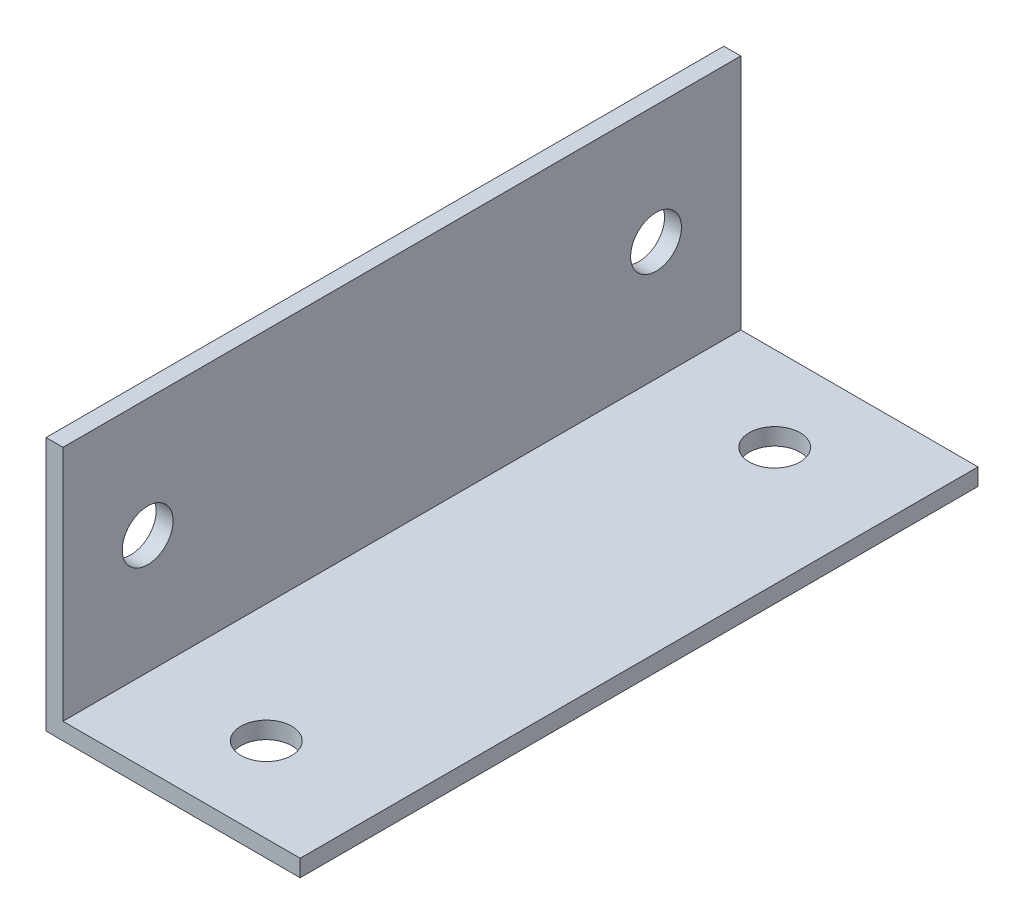
from build123d import *

# Parameters (mm, degrees)
EXTRUDE_1_DEPTH     = 40
SKETCH_2_R          = 1.5
CUT_EXTRUDE_1_DEPTH = 45.631827209


with BuildPart() as part:
    # 草图1 → 凸台-拉伸1 (new body)
    with BuildSketch(Plane.XY):
        Polygon((0, 0), (0, 14), (-1, 14), (-1, -1), (14, -1), (14, 0), align=None)
    extrude(amount=EXTRUDE_1_DEPTH)

    # 草图2 → 切除-拉伸1 (cut, through all)
    with BuildSketch(Plane(origin=(0, 0, 0), x_dir=(1, 0, 0), z_dir=(0, 1, 0))):
        with Locations(Location((7, -5, 0), (0, 0, 180))):
            Circle(SKETCH_2_R)
        with Locations((7, -35)):
            Circle(SKETCH_2_R)
    cut_extrude_1 = extrude(amount=-CUT_EXTRUDE_1_DEPTH, mode=Mode.SUBTRACT)

    # 镜向1: 切除-拉伸1 across plane
    add(cut_extrude_1.mirror(Plane(origin=(0, 0, 0), x_dir=(0, 0, 1), z_dir=(-0.7071067811865476, 0.7071067811865475, 0))), mode=Mode.SUBTRACT)


solid = part.part
